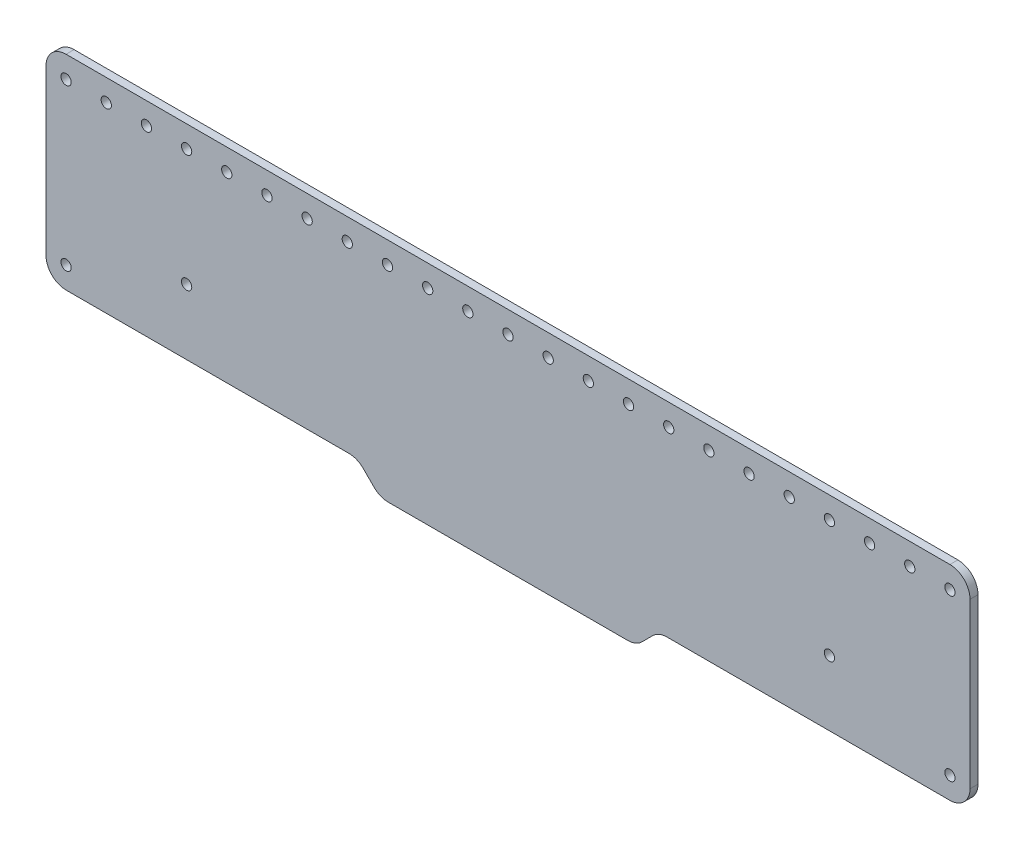
from build123d import *

# Parameters (mm, degrees)
SKETCH1_W           = 368
SKETCH1_H           = 90.35
SKETCH1_R           = 2.05
BOSS_EXTRUDE1_DEPTH = 3.175
SKETCH3_R           = 2.05
CUT_EXTRUDE1_DEPTH  = 3.18
CUT_EXTRUDE2_DEPTH  = 10
FILLET1_R           = 8


with BuildPart() as part:
    # Sketch1 → Boss-Extrude1 (new body)
    with BuildSketch(Plane.XY):
        Rectangle(SKETCH1_W, SKETCH1_H)
        with Locations((-128, -10.175)):
            Circle(SKETCH1_R, mode=Mode.SUBTRACT)
        with Locations(Location((128, -10.175, 0), (0, 0, 180))):
            Circle(SKETCH1_R, mode=Mode.SUBTRACT)
    extrude(amount=BOSS_EXTRUDE1_DEPTH)

    # Sketch3 → Cut-Extrude1 (cut)
    with BuildSketch(Plane.XY.offset(3.175)):
        with Locations((-176, 36.5)):
            Circle(SKETCH3_R)
        with Locations((-160, 36.5)):
            Circle(SKETCH3_R)
        with Locations((-144, 36.5)):
            Circle(SKETCH3_R)
        with Locations((-128, 36.5)):
            Circle(SKETCH3_R)
        with Locations((-112, 36.5)):
            Circle(SKETCH3_R)
        with Locations((-96, 36.5)):
            Circle(SKETCH3_R)
        with Locations((-80, 36.5)):
            Circle(SKETCH3_R)
        with Locations((-64, 36.5)):
            Circle(SKETCH3_R)
        with Locations((-48, 36.5)):
            Circle(SKETCH3_R)
        with Locations((-32, 36.5)):
            Circle(SKETCH3_R)
        with Locations((-16, 36.5)):
            Circle(SKETCH3_R)
        with Locations((0, 36.5)):
            Circle(SKETCH3_R)
        with Locations((16, 36.5)):
            Circle(SKETCH3_R)
        with Locations((32, 36.5)):
            Circle(SKETCH3_R)
        with Locations((48, 36.5)):
            Circle(SKETCH3_R)
        with Locations((64, 36.5)):
            Circle(SKETCH3_R)
        with Locations((80, 36.5)):
            Circle(SKETCH3_R)
        with Locations((96, 36.5)):
            Circle(SKETCH3_R)
        with Locations((112, 36.5)):
            Circle(SKETCH3_R)
        with Locations((128, 36.5)):
            Circle(SKETCH3_R)
        with Locations((144, 36.5)):
            Circle(SKETCH3_R)
        with Locations((160, 36.5)):
            Circle(SKETCH3_R)
        with Locations((176, 36.5)):
            Circle(SKETCH3_R)
        with Locations((176, -27.5)):
            Circle(SKETCH3_R)
        with Locations((-176, -27.5)):
            Circle(SKETCH3_R)
    extrude(amount=-CUT_EXTRUDE1_DEPTH, mode=Mode.SUBTRACT)

    # Sketch4 → Cut-Extrude2 (cut)
    with BuildSketch(Plane.XY.offset(3.175)):
        Polygon((-184, -36.18), (-60, -36.18), (-51.005, -45.175), (-184, -45.175), align=None)
        Polygon((184, -36.18), (184, -45.175), (51.005, -45.175), (60, -36.18), align=None)
    extrude(amount=-CUT_EXTRUDE2_DEPTH, mode=Mode.SUBTRACT)

    # Fillet1
    fillet1_edges = [part.edges().sort_by_distance(p)[0] for p in [
        (184, -36.18, 1.5875),
        (-51.005, -45.175, 1.5875),
        (-184, -36.18, 1.5875),
        (-60, -36.18, 1.5875),
        (60, -36.18, 1.5875),
        (51.005, -45.175, 1.5875),
        (-184, 45.175, 1.5875),
        (184, 45.175, 1.5875),
    ]]
    fillet(fillet1_edges, radius=FILLET1_R)


solid = part.part
